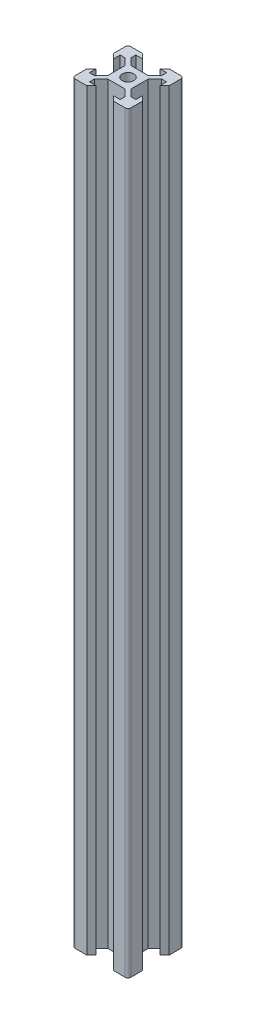
from build123d import *

# Parameters (mm, degrees)
MASTERLAYOUTSKETCH_R = 2.1
MAIN_EXTRUSION_DEPTH = 270
EDGE_FILLETS_R       = 1


with BuildPart() as part:
    # MasterLayoutSketch → Main Extrusion (new body)
    with BuildSketch(Plane(origin=(0, 0, 0), x_dir=(1, 0, 0), z_dir=(0, 1, 0))):
        Polygon((-8.325, 3.1), (-8.325, 5.5), (-6.560660172, 5.5), (-4.160660172, 3.1), (-4.160660172, -3.1), (-6.560660172, -5.5), (-8.325, -5.5), (-8.325, -3.1), (-10, -4.775), (-10, -10), (-4.775, -10), (-3.1, -8.325), (-5.5, -8.325), (-5.5, -6.560660172), (-3.1, -4.160660172), (3.1, -4.160660172), (5.5, -6.560660172), (5.5, -8.325), (3.1, -8.325), (4.775, -10), (10, -10), (10, -4.775), (8.325, -3.1), (8.325, -5.5), (6.560660172, -5.5), (4.160660172, -3.1), (4.160660172, 3.1), (6.560660172, 5.5), (8.325, 5.5), (8.325, 3.1), (10, 4.775), (10, 10), (4.775, 10), (3.1, 8.325), (5.5, 8.325), (5.5, 6.560660172), (3.1, 4.160660172), (-3.1, 4.160660172), (-5.5, 6.560660172), (-5.5, 8.325), (-3.1, 8.325), (-4.775, 10), (-10, 10), (-10, 4.775), align=None)
        with Locations(Location((0, 0, 0), (0, 0, 270))):
            Circle(MASTERLAYOUTSKETCH_R, mode=Mode.SUBTRACT)
    extrude(amount=MAIN_EXTRUSION_DEPTH)

    # Edge Fillets
    edge_fillets_edges = [part.edges().sort_by_distance(p)[0] for p in [
        (10, 135, -10),
        (10, 135, 10),
        (-10, 135, 10),
        (-10, 135, -10),
    ]]
    fillet(edge_fillets_edges, radius=EDGE_FILLETS_R)


solid = part.part
